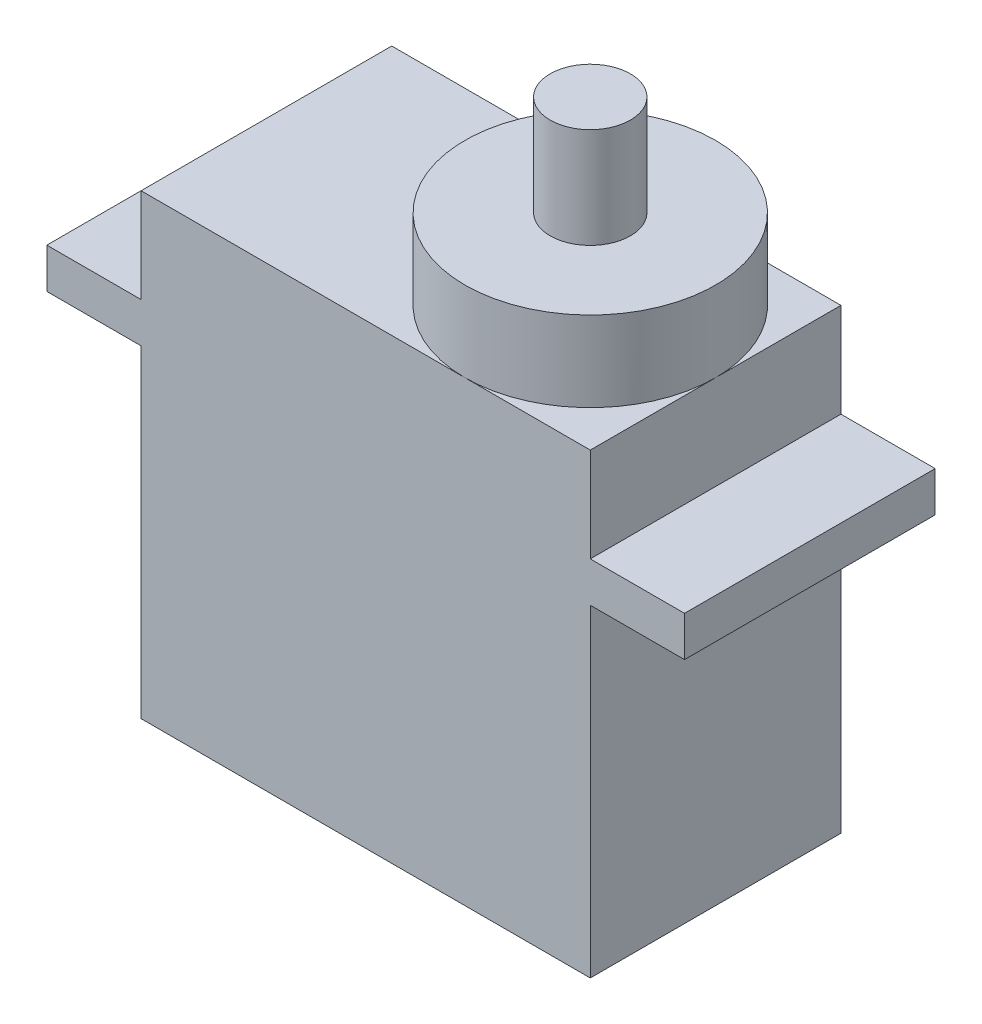
from build123d import *

# Parameters (mm, degrees)
SKETCH_1_W      = 22.4
SKETCH_1_H      = 22.8
EXTRUDE_1_DEPTH = 6.25
SKETCH_4_W      = 4.7
SKETCH_4_H      = 2
EXTRUDE_2_DEPTH = 12.5
SKETCH_5_R      = 6.25
EXTRUDE_3_DEPTH = 4
SKETCH_6_R      = 2
EXTRUDE_4_DEPTH = 5


with BuildPart() as part:
    # 草图1 → 凸台-拉伸1 (new, symmetric)
    with BuildSketch(Plane.XY):
        Rectangle(SKETCH_1_W, SKETCH_1_H)
    extrude(amount=EXTRUDE_1_DEPTH, both=True)

    # 草图4 → 凸台-拉伸2 (add)
    with BuildSketch(Plane.XY.offset(6.25)):
        with Locations((-13.55, 5.7)):
            Rectangle(SKETCH_4_W, SKETCH_4_H)
        with Locations((13.55, 5.7)):
            Rectangle(SKETCH_4_W, SKETCH_4_H)
    extrude(amount=-EXTRUDE_2_DEPTH)

    # 草图5 → 凸台-拉伸3 (add)
    with BuildSketch(Plane(origin=(0, 11.4, 0), x_dir=(1, 0, 0), z_dir=(0, 1, 0))):
        with Locations(Location((4.95, 0, 0), (0, 0, 270))):
            Circle(SKETCH_5_R)
    extrude(amount=EXTRUDE_3_DEPTH)

    # 草图6 → 凸台-拉伸4 (add)
    with BuildSketch(Plane(origin=(0, 15.4, 0), x_dir=(1, 0, 0), z_dir=(0, 1, 0))):
        with Locations(Location((4.95, 0, 0), (0, 0, 270))):
            Circle(SKETCH_6_R)
    extrude(amount=EXTRUDE_4_DEPTH)


solid = part.part
